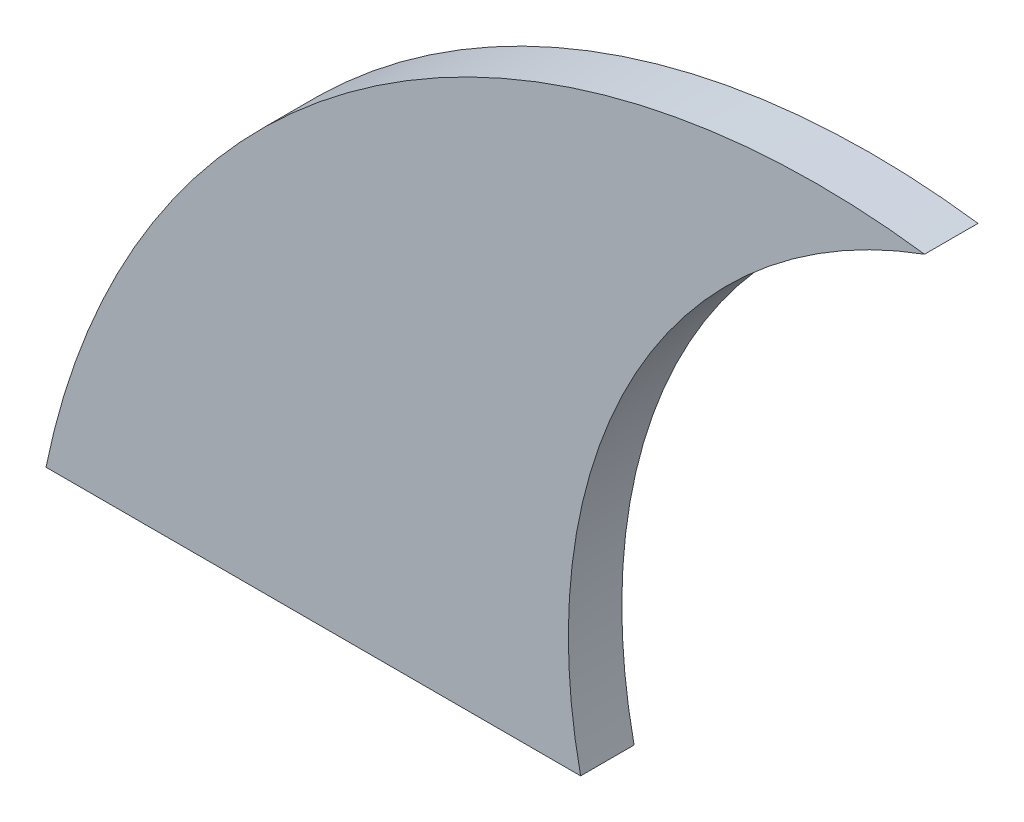
from build123d import *

# Parameters (mm, degrees)
BOSS_EXTRUDE1_DEPTH = 3


with BuildPart() as part:
    # Sketch1 → Boss-Extrude1 (new body)
    with BuildSketch(Plane.XY):
        with BuildLine():
            Line((0, 0), (30, 0))
            ThreePointArc((30, 0), (33.089528508, 21.116818912), (49.298245614, 35))
            ThreePointArc((49.298245614, 35), (17.728022823, 27.248516769), (0, 0))
        make_face()
    extrude(amount=BOSS_EXTRUDE1_DEPTH)


solid = part.part
